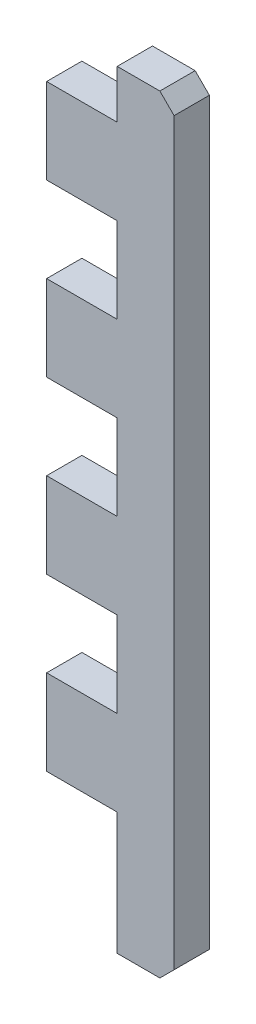
from build123d import *

# Parameters (mm, degrees)
BOSS_EXTRUDE1_DEPTH = 12.4


with BuildPart() as part:
    # Model → Boss-Extrude1 (new body)
    with BuildSketch(Plane.XY):
        Polygon((0, 193), (0, 223), (-24.8, 223), (-24.8, 253), (0, 253), (0, 270), (15, 270), (20, 265), (20, 5), (15, 0), (0, 0), (0, 43), (-24.8, 43), (-24.8, 73), (0, 73), (0, 103), (-24.8, 103), (-24.8, 133), (0, 133), (0, 163), (-24.8, 163), (-24.8, 193), align=None)
    extrude(amount=BOSS_EXTRUDE1_DEPTH)


solid = part.part
